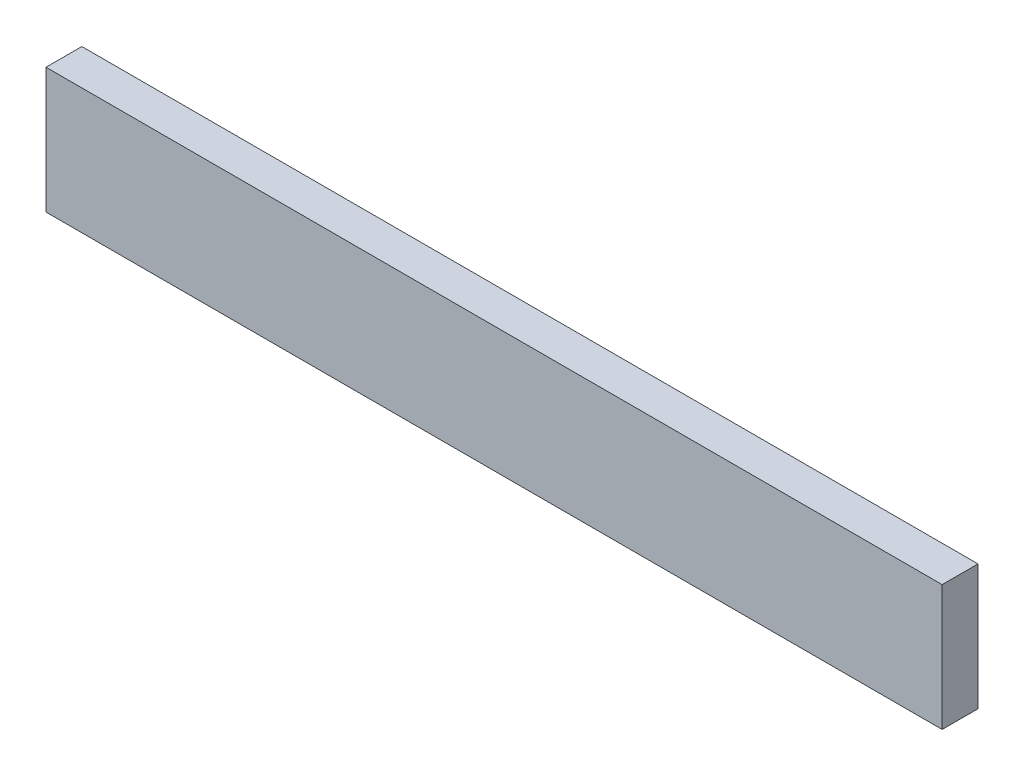
from build123d import *

# Parameters (mm, degrees)
SKETCH_1_W      = 500
SKETCH_1_H      = 70
EXTRUDE_1_DEPTH = 20


with BuildPart() as part:
    # 草图1 → 凸台-拉伸1 (new body)
    with BuildSketch(Plane.XY):
        Rectangle(SKETCH_1_W, SKETCH_1_H)
    extrude(amount=EXTRUDE_1_DEPTH)


solid = part.part
